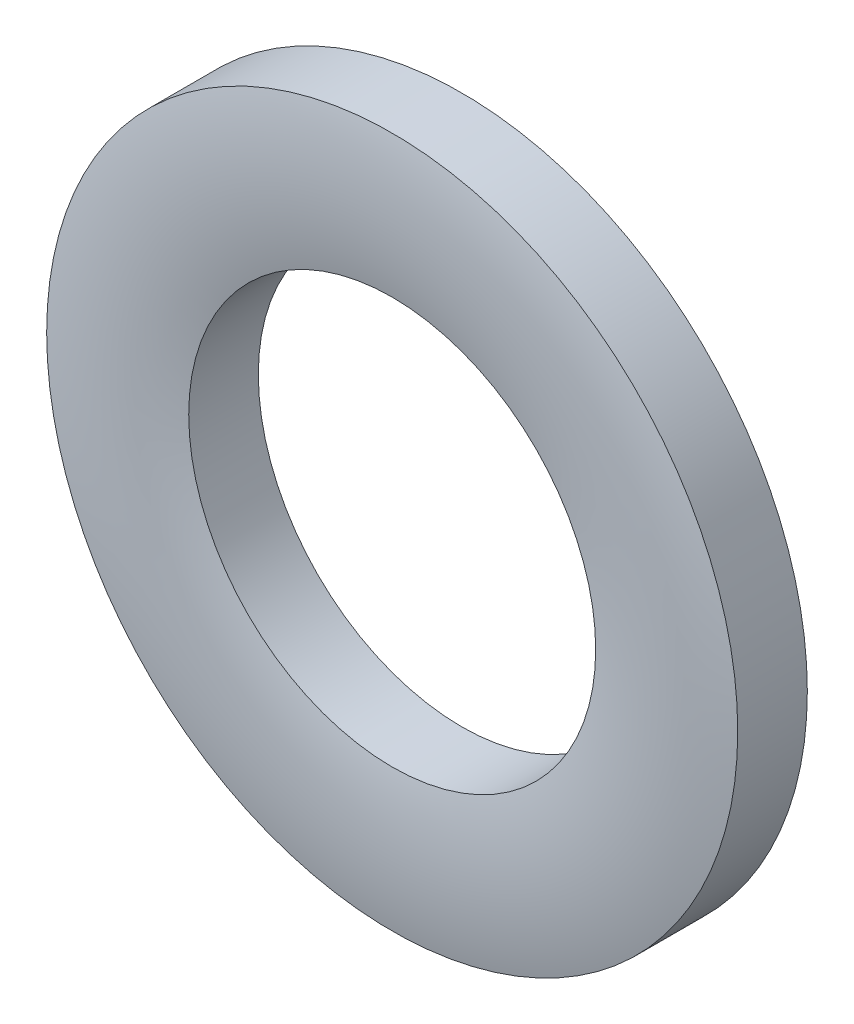
from build123d import *


with BuildPart() as part:
    # Sketch3 → Revolve1 (revolve)
    with BuildSketch(Plane(origin=(0, 0, 0), x_dir=(0, 0, -1), z_dir=(1, 0, 0)), mode=Mode.PRIVATE) as revolve1_sk:
        with BuildLine():
            Line((0.5, 4.5), (-0.4063, 4.5))
            ThreePointArc((-0.4063, 4.5), (-0.5, 3.575), (-0.4063, 2.65))
            Line((-0.4063, 2.65), (0.5, 2.65))
            Line((0.5, 2.65), (0.5, 4.5))
        make_face()
    revolve(revolve1_sk.sketch.rotate(Axis((0, 0, 0.5), (0, 0, -1)), 90), axis=Axis((0, 0, 0.5), (0, 0, -1)))


solid = part.part
